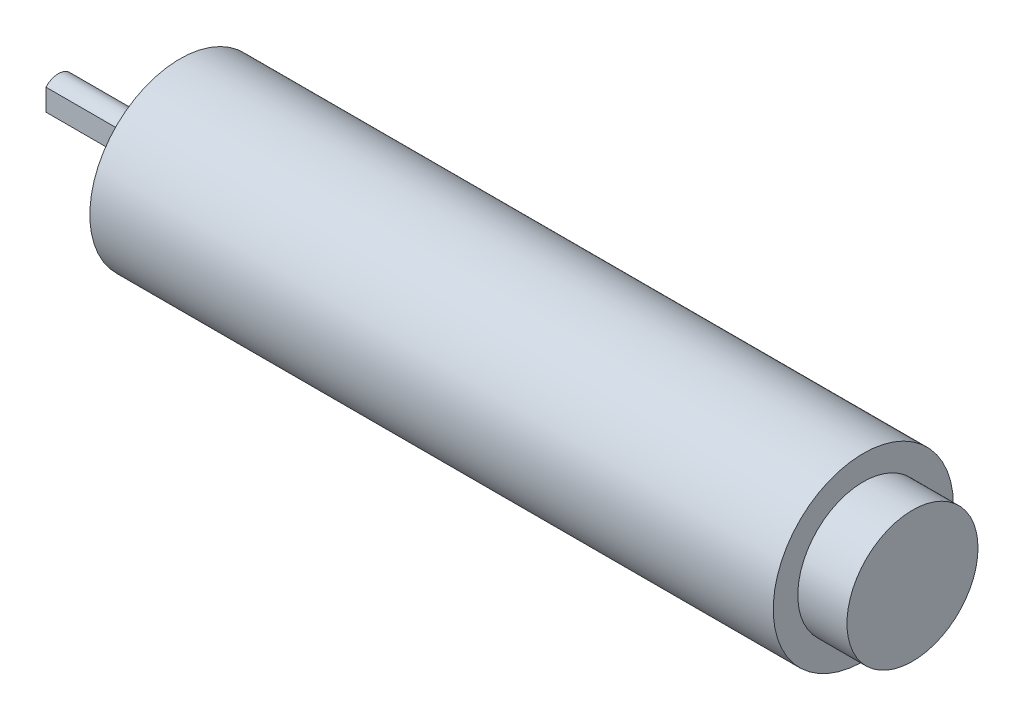
from build123d import *

# Parameters (mm, degrees)
SKETCH1_W           = 52.6
SKETCH1_H           = 11
SKETCH2_R           = 5
BOSS_EXTRUDE1_DEPTH = 1.35
SKETCH3_R           = 3.5
BOSS_EXTRUDE2_DEPTH = 1.8
SKETCH4_R           = 2
BOSS_EXTRUDE3_DEPTH = 11.7
CUT_EXTRUDE1_REACH  = 71.221
HOLE1_D             = 1.95
HOLE1_DEPTH         = 6.5
HOLE2_D             = 1.95
HOLE2_DEPTH         = 6.5
HOLE3_D             = 1.95
HOLE3_DEPTH         = 6.5
HOLE4_D             = 7
HOLE4_DEPTH         = 6.4
HOLE5_D             = 2.1
HOLE5_DEPTH         = 3
HOLE6_D             = 2.1
HOLE6_DEPTH         = 3
HOLE7_D             = 2.1
HOLE7_DEPTH         = 3
SKETCH25_R          = 11
BOSS_EXTRUDE4_DEPTH = 36.83
SKETCH26_R          = 12
SKETCH26_R_2        = 8
CUT_EXTRUDE2_DEPTH  = 6


with BuildPart() as part:
    # Sketch1 → Revolve1 (revolve)
    with BuildSketch(Plane.XY, mode=Mode.PRIVATE) as revolve1_sk:
        with Locations((26.3, 5.5)):
            Rectangle(SKETCH1_W, SKETCH1_H)
    revolve(revolve1_sk.sketch.rotate(Axis((0, 0, 0), (1, 0, 0)), 270), axis=Axis((0, 0, 0), (1, 0, 0)))

    # Sketch2 → Boss-Extrude1 (add)
    with BuildSketch(Plane.ZY):
        with Locations(Location((0, 0, 0), (0, 0, 180))):
            Circle(SKETCH2_R)
    extrude(amount=BOSS_EXTRUDE1_DEPTH)

    # Sketch3 → Boss-Extrude2 (add)
    with BuildSketch(Plane.ZY.offset(1.35)):
        Circle(SKETCH3_R)
    extrude(amount=BOSS_EXTRUDE2_DEPTH)

    # Sketch4 → Boss-Extrude3 (add)
    with BuildSketch(Plane.ZY.offset(3.15)):
        Circle(SKETCH4_R)
    extrude(amount=BOSS_EXTRUDE3_DEPTH)

    # Cut-Extrude1: up to this plane
    cut_extrude1_end = Plane(origin=(-3.675, 0, 3.675), z_dir=(0.707106781186547, 0, -0.707106781186548))
    # Sketch6 → Cut-Extrude1 (cut, up to the surface)
    with BuildSketch(Plane.ZY.offset(14.85), mode=Mode.PRIVATE) as cut_extrude1_sk1:
        with BuildLine():
            Line((1.5, 1.322875656), (1.5, -1.322875656))
            ThreePointArc((1.5, -1.322875656), (2, 0), (1.5, 1.322875656))
        make_face()
    cut_extrude1_tool1 = split(extrude(cut_extrude1_sk1.sketch, amount=-CUT_EXTRUDE1_REACH, mode=Mode.PRIVATE), bisect_by=cut_extrude1_end, keep=Keep.BOTH, mode=Mode.PRIVATE)
    add(cut_extrude1_tool1.solids().sort_by_distance((-14.85, 0, 1.702311))[0], mode=Mode.SUBTRACT)

    # Hole1
    with Locations(Plane.ZY):
        with Locations((7, 0)):
            Hole(HOLE1_D / 2, depth=HOLE1_DEPTH)

    # Hole2
    with Locations(Plane.ZY):
        with Locations((-3.5, -6.062177826)):
            Hole(HOLE2_D / 2, depth=HOLE2_DEPTH)

    # Hole3
    with Locations(Plane.ZY):
        with Locations((-3.5, 6.062177826)):
            Hole(HOLE3_D / 2, depth=HOLE3_DEPTH)

    # Hole4
    with Locations(Plane(origin=(52.6, 0, 0), x_dir=(0, 0, -1), z_dir=(1, 0, 0))):
        with Locations((0, 0)):
            Hole(HOLE4_D / 2, depth=HOLE4_DEPTH)

    # Hole5
    with Locations(Plane(origin=(52.6, 0, 0), x_dir=(0, 0, -1), z_dir=(1, 0, 0))):
        with Locations((-8.5, 0)):
            Hole(HOLE5_D / 2, depth=HOLE5_DEPTH)

    # Hole6
    with Locations(Plane(origin=(52.6, 0, 0), x_dir=(0, 0, -1), z_dir=(1, 0, 0))):
        with Locations((4.25, -7.361215932)):
            Hole(HOLE6_D / 2, depth=HOLE6_DEPTH)

    # Hole7
    with Locations(Plane(origin=(52.6, 0, 0), x_dir=(0, 0, -1), z_dir=(1, 0, 0))):
        with Locations((4.25, 7.361215932)):
            Hole(HOLE7_D / 2, depth=HOLE7_DEPTH)

    # Sketch25 → Boss-Extrude4 (add)
    with BuildSketch(Plane(origin=(52.6, 0, 0), x_dir=(0, 0, -1), z_dir=(1, 0, 0))):
        Circle(SKETCH25_R)
    extrude(amount=BOSS_EXTRUDE4_DEPTH)

    # Sketch26 → Cut-Extrude2 (cut)
    with BuildSketch(Plane(origin=(89.43, 0, 0), x_dir=(0, 0, -1), z_dir=(1, 0, 0))):
        Circle(SKETCH26_R)
        Circle(SKETCH26_R_2, mode=Mode.SUBTRACT)
    extrude(amount=-CUT_EXTRUDE2_DEPTH, mode=Mode.SUBTRACT)


solid = part.part
